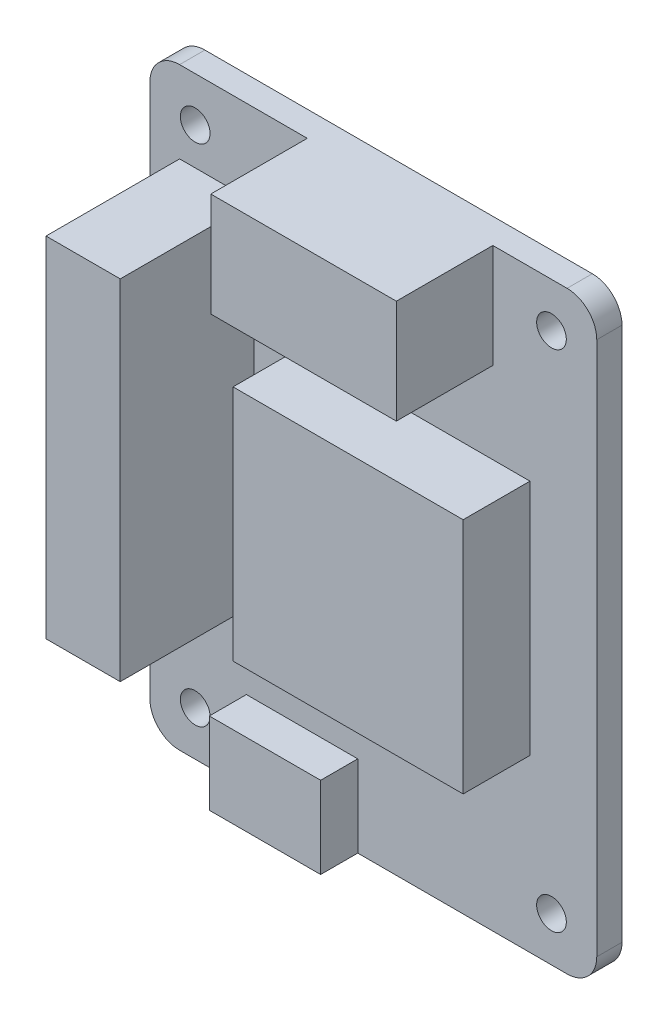
from build123d import *

# Parameters (mm, degrees)
SKETCH_1_W      = 30.1
SKETCH_1_H      = 40
SKETCH_1_R      = 1
EXTRUDE_1_DEPTH = 1.7
SKETCH_2_W      = 5
SKETCH_2_H      = 23.5
EXTRUDE_2_DEPTH = 9
SKETCH_3_W      = 15.5
SKETCH_3_H      = 16
EXTRUDE_3_DEPTH = 4.5
SKETCH_4_W      = 12.5
SKETCH_4_H      = 7
EXTRUDE_4_DEPTH = 6.5
SKETCH_5_W      = 7.5
SKETCH_5_H      = 5.5
EXTRUDE_5_DEPTH = 2.5
FILLET_1_R      = 2


with BuildPart() as part:
    # 草图1 → 凸台-拉伸1 (new body)
    with BuildSketch(Plane.XY):
        Rectangle(SKETCH_1_W, SKETCH_1_H)
        with Locations((12, 17)):
            Circle(SKETCH_1_R, mode=Mode.SUBTRACT)
        with Locations((-12, 17)):
            Circle(SKETCH_1_R, mode=Mode.SUBTRACT)
        with Locations((-12, -17)):
            Circle(SKETCH_1_R, mode=Mode.SUBTRACT)
        with Locations((12, -17)):
            Circle(SKETCH_1_R, mode=Mode.SUBTRACT)
    extrude(amount=EXTRUDE_1_DEPTH)

    # 草图2 → 凸台-拉伸2 (add)
    with BuildSketch(Plane.XY.offset(1.7)):
        with Locations((-10.55, 2.75)):
            Rectangle(SKETCH_2_W, SKETCH_2_H)
    extrude(amount=EXTRUDE_2_DEPTH)

    # 草图3 → 凸台-拉伸3 (add)
    with BuildSketch(Plane.XY.offset(1.7)):
        with Locations((2.8, -0.5)):
            Rectangle(SKETCH_3_W, SKETCH_3_H)
    extrude(amount=EXTRUDE_3_DEPTH)

    # 草图4 → 凸台-拉伸4 (add)
    with BuildSketch(Plane.XY.offset(1.7)):
        with Locations((1.8, 16.5)):
            Rectangle(SKETCH_4_W, SKETCH_4_H)
    extrude(amount=EXTRUDE_4_DEPTH)

    # 草图5 → 凸台-拉伸5 (add)
    with BuildSketch(Plane.XY.offset(1.7)):
        with Locations((-4.8, -17.25)):
            Rectangle(SKETCH_5_W, SKETCH_5_H)
    extrude(amount=EXTRUDE_5_DEPTH)

    # 圆角1
    fillet_1_edges = [part.edges().sort_by_distance(p)[0] for p in [
        (-15.05, 20, 0.85),
        (15.05, 20, 0.85),
        (15.05, -20, 0.85),
        (-15.05, -20, 0.85),
    ]]
    fillet(fillet_1_edges, radius=FILLET_1_R)


solid = part.part
